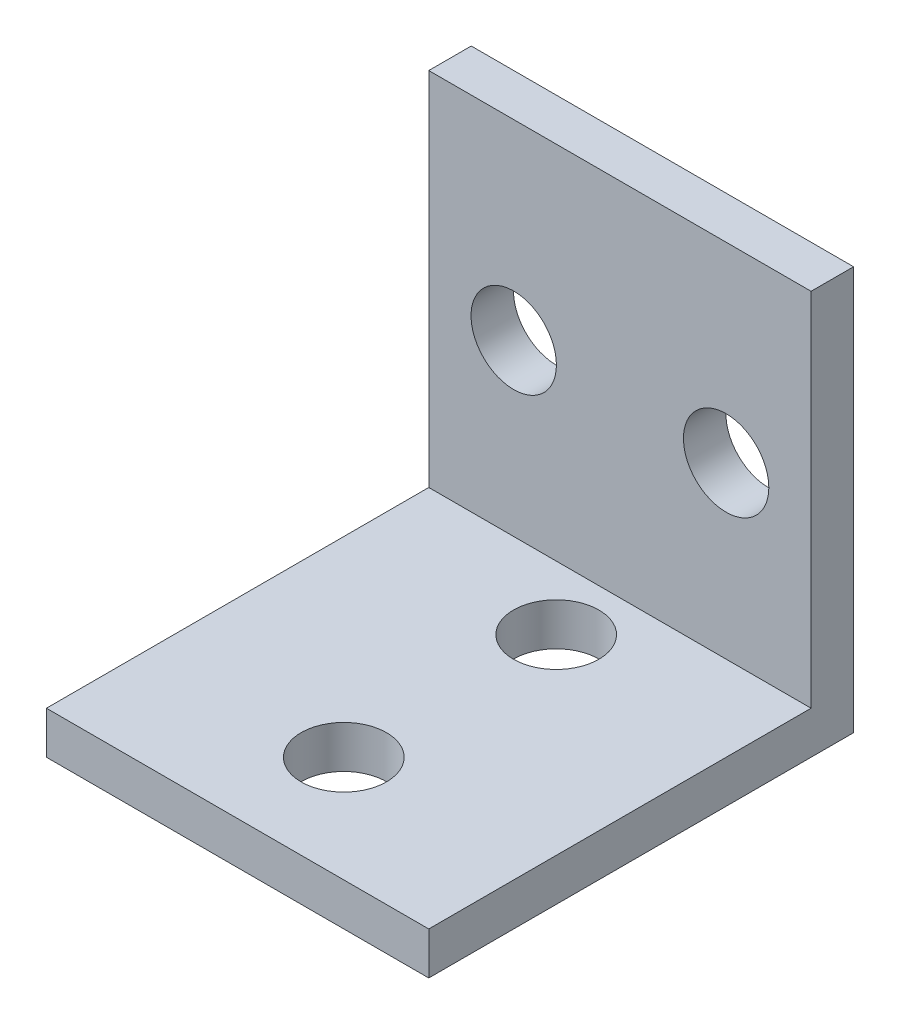
from build123d import *

# Parameters (mm, degrees)
SKETCH1_W           = 22.86
SKETCH1_H           = 25.4
BOSS_EXTRUDE1_DEPTH = 24.13
SKETCH2_W           = 22.86
SKETCH2_H           = 21.59
CUT_EXTRUDE1_DEPTH  = 42.832959494
SKETCH3_R           = 2.5527
CUT_EXTRUDE2_DEPTH  = 41.421129376
SKETCH4_R           = 2.5527
CUT_EXTRUDE3_DEPTH  = 41.341245643


with BuildPart() as part:
    # Sketch1 → Boss-Extrude1 (new body)
    with BuildSketch(Plane(origin=(0, 0, 0), x_dir=(1, 0, 0), z_dir=(0, 1, 0))):
        with Locations((11.43, 12.7)):
            Rectangle(SKETCH1_W, SKETCH1_H)
    extrude(amount=BOSS_EXTRUDE1_DEPTH)

    # Sketch2 → Cut-Extrude1 (cut, through all)
    with BuildSketch(Plane(origin=(22.86, 0, 0), x_dir=(0, 0, -1), z_dir=(1, 0, 0))):
        with Locations((11.43, 13.335)):
            Rectangle(SKETCH2_W, SKETCH2_H)
    extrude(amount=-CUT_EXTRUDE1_DEPTH, mode=Mode.SUBTRACT)

    # Sketch3 → Cut-Extrude2 (cut, through all)
    with BuildSketch(Plane(origin=(0, 2.54, 0), x_dir=(1, 0, 0), z_dir=(0, 1, 0))):
        with Locations(Location((11.43, 6.35, 0), (0, 0, 270))):
            Circle(SKETCH3_R)
        with Locations(Location((11.43, 19.05, 0), (0, 0, 270))):
            Circle(SKETCH3_R)
    extrude(amount=-CUT_EXTRUDE2_DEPTH, mode=Mode.SUBTRACT)

    # Sketch4 → Cut-Extrude3 (cut, through all)
    with BuildSketch(Plane.XY.offset(-22.86)):
        with Locations((17.78, 12.7)):
            Circle(SKETCH4_R)
        with Locations((5.08, 12.7)):
            Circle(SKETCH4_R)
    extrude(amount=-CUT_EXTRUDE3_DEPTH, mode=Mode.SUBTRACT)


solid = part.part
